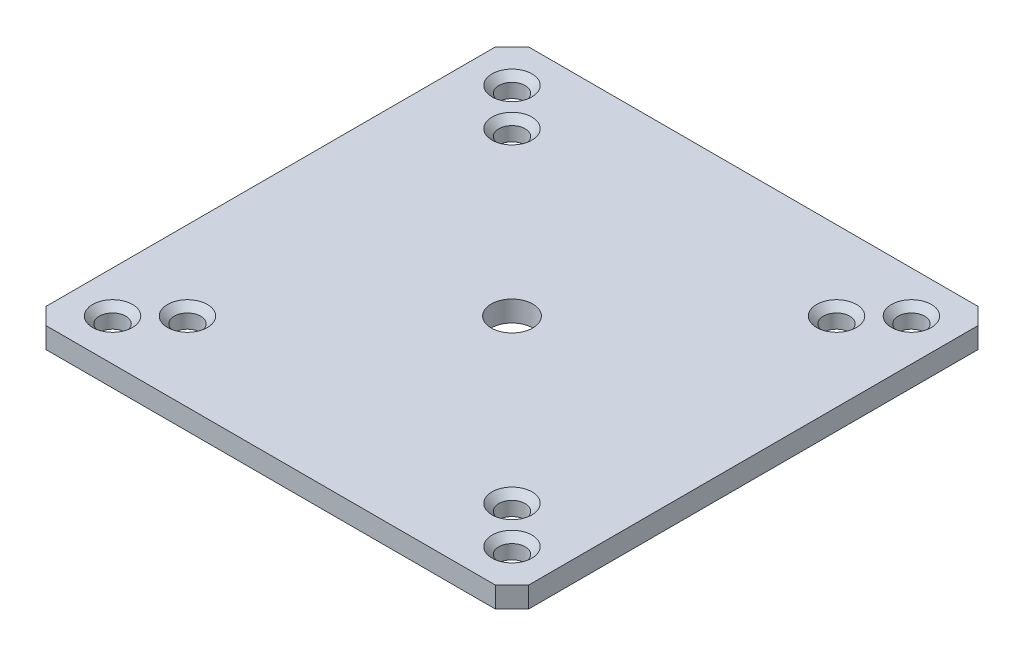
from build123d import *

# Parameters (mm, degrees)
SKETCH1_W                        = 73.66
SKETCH1_H                        = 73.66
SKETCH1_R                        = 3.175
BOSS_EXTRUDE1_DEPTH              = 3.175
CHAMFER2_SIZE                    = 2.54
F_10_32_TAPPED_HOLE1_D           = 4.0386
F_10_32_TAPPED_HOLE1_CSINK_D     = 6.096
F_10_32_TAPPED_HOLE1_CSINK_ANGLE = 90
F_10_32_TAPPED_HOLE2_D           = 4.0386
F_10_32_TAPPED_HOLE2_CSINK_D     = 6.096
F_10_32_TAPPED_HOLE2_CSINK_ANGLE = 90


with BuildPart() as part:
    # Sketch1 → Boss-Extrude1 (new body)
    with BuildSketch(Plane(origin=(0, 0, 0), x_dir=(1, 0, 0), z_dir=(0, 1, 0))):
        Rectangle(SKETCH1_W, SKETCH1_H)
        with Locations(Location((0, 0, 0), (0, 0, 270))):
            Circle(SKETCH1_R, mode=Mode.SUBTRACT)
    extrude(amount=BOSS_EXTRUDE1_DEPTH)

    # Chamfer2
    chamfer2_edges = [part.edges().sort_by_distance(p)[0] for p in [
        (-36.83, 1.5875, -36.83),
        (36.83, 1.5875, -36.83),
        (36.83, 1.5875, 36.83),
        (-36.83, 1.5875, 36.83),
    ]]
    chamfer(chamfer2_edges, length=CHAMFER2_SIZE)

    # #10-32 Tapped Hole1 (through all)
    with Locations(Plane(origin=(0, 3.175, 0), x_dir=(1, 0, 0), z_dir=(0, 1, 0))):
        with Locations((30.48, 30.48), (-30.48, 30.48), (-30.48, -30.48), (30.48, -30.48)):
            CounterSinkHole(F_10_32_TAPPED_HOLE1_D / 2, F_10_32_TAPPED_HOLE1_CSINK_D / 2, counter_sink_angle=F_10_32_TAPPED_HOLE1_CSINK_ANGLE)

    # #10-32 Tapped Hole2 (through all)
    with Locations(Plane(origin=(0, 3.175, 0), x_dir=(1, 0, 0), z_dir=(0, 1, 0))):
        with Locations((-24.765, 24.765), (24.765, 24.765), (-24.765, -24.765), (24.765, -24.765)):
            CounterSinkHole(F_10_32_TAPPED_HOLE2_D / 2, F_10_32_TAPPED_HOLE2_CSINK_D / 2, counter_sink_angle=F_10_32_TAPPED_HOLE2_CSINK_ANGLE)


solid = part.part
